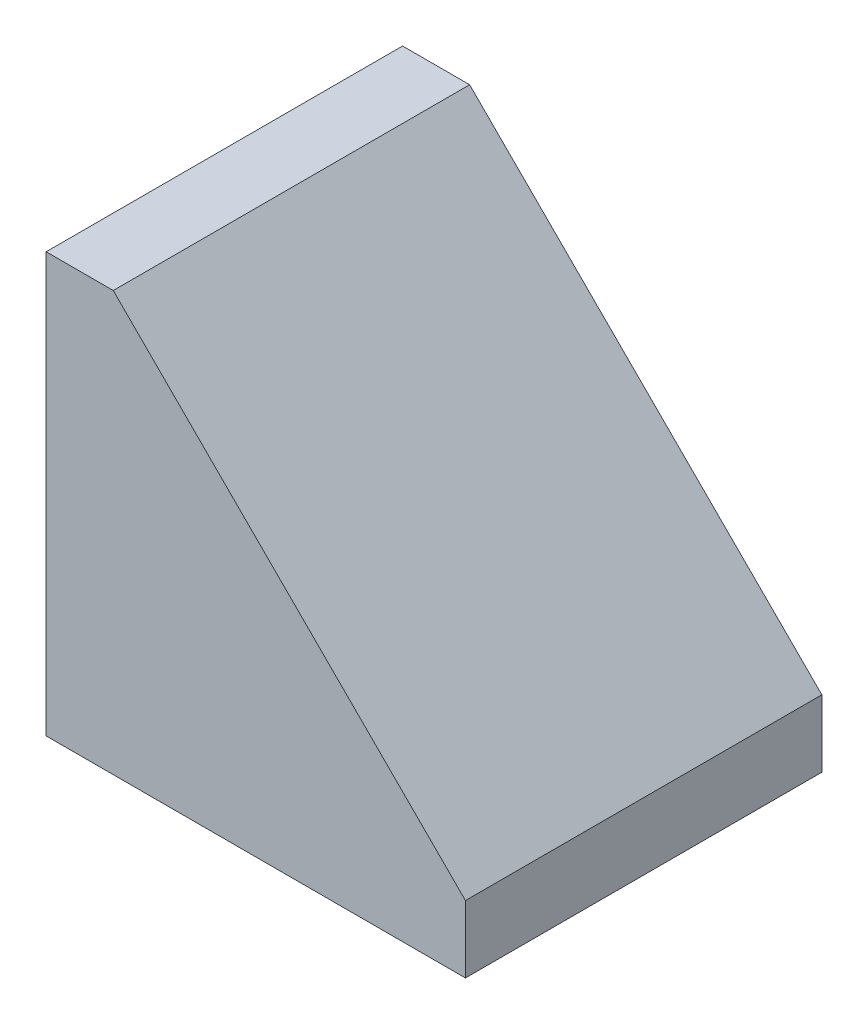
from build123d import *

# Parameters (mm, degrees)
EXTRUDE_1_DEPTH = 17


with BuildPart() as part:
    # 草圖1 → 填料-伸長1 (new body)
    with BuildSketch(Plane.XY):
        Polygon((0, 20), (0, 0), (20, 0), (20, 3.2), (3.2, 20), align=None)
    extrude(amount=EXTRUDE_1_DEPTH)


solid = part.part
